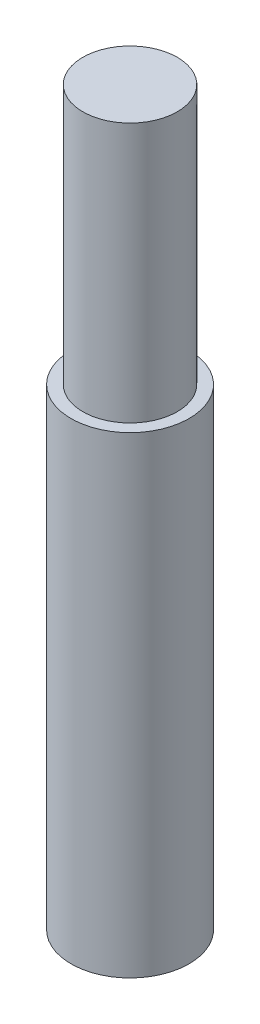
from build123d import *

# Parameters (mm, degrees)
IZIM2_R               = 2
KES_EKSTR_ZYON1_DEPTH = 10
RADYUS1_R             = 0.4


with BuildPart() as part:
    # Çizim1 → Döndür1 (revolve)
    with BuildSketch(Plane.XY, mode=Mode.PRIVATE) as d_nd_r1_sk:
        Polygon((0, 0), (0, 31), (2, 31), (2, 20), (2.5, 20), (2.5, 0), align=None)
    revolve(d_nd_r1_sk.sketch.rotate(Axis((0, 0, 0), (0, 1, 0)), 90), axis=Axis((0, 0, 0), (0, 1, 0)))

    # Çizim2 → Kes-Ekstrüzyon1 (cut)
    with BuildSketch(Plane.XZ):
        with Locations(Location((0, 0, 0), (0, 0, 270))):
            Circle(IZIM2_R)
    extrude(amount=-KES_EKSTR_ZYON1_DEPTH, mode=Mode.SUBTRACT)

    # Radyus1
    radyus1_edges = [part.edges().sort_by_distance(p)[0] for p in [
        (0, 0, 2),
    ]]
    fillet(radyus1_edges, radius=RADYUS1_R)


solid = part.part
